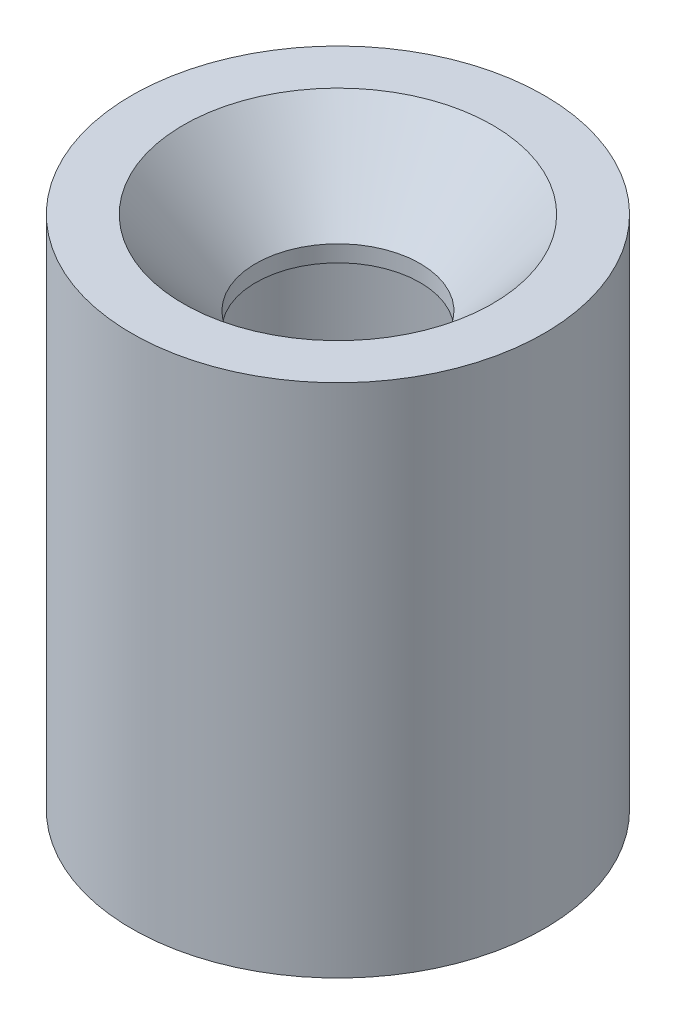
from build123d import *


with BuildPart() as part:
    # Sketch1 → Revolve1 (revolve)
    with BuildSketch(Plane.XY, mode=Mode.PRIVATE) as revolve1_sk:
        Polygon((6.35, 0), (6.35, 15.875), (4.7625, 15.875), (2.5273, 13.303696536), (2.5273, 12.795696536), (4.9022, 12.795696536), (4.9022, 0), align=None)
    revolve(revolve1_sk.sketch.rotate(Axis((0, 0, 0), (0, 1, 0)), 90), axis=Axis((0, 0, 0), (0, 1, 0)))


solid = part.part
